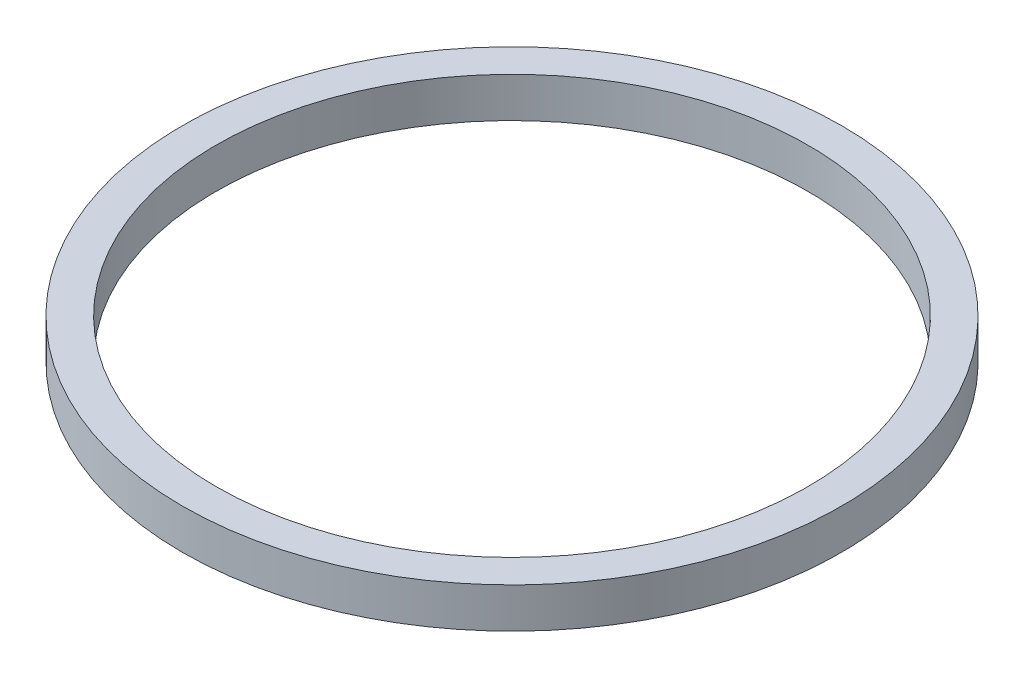
from build123d import *

# Parameters (mm, degrees)
SKETCH3_R           = 12.33233452
SKETCH3_R_2         = 11.071859559
BOSS_EXTRUDE2_DEPTH = 1.5


with BuildPart() as part:
    # Sketch3 → Boss-Extrude2 (new body)
    with BuildSketch(Plane(origin=(0, -876.833041125, 0), x_dir=(1, 0, 0), z_dir=(0, 1, 0))):
        with Locations(Location((1340.770095211, 694.117887031, 0), (0, 0, 270))):
            Circle(SKETCH3_R)
        with Locations(Location((1340.770095211, 694.117887031, 0), (0, 0, 270))):
            Circle(SKETCH3_R_2, mode=Mode.SUBTRACT)
    extrude(amount=BOSS_EXTRUDE2_DEPTH)


solid = part.part
